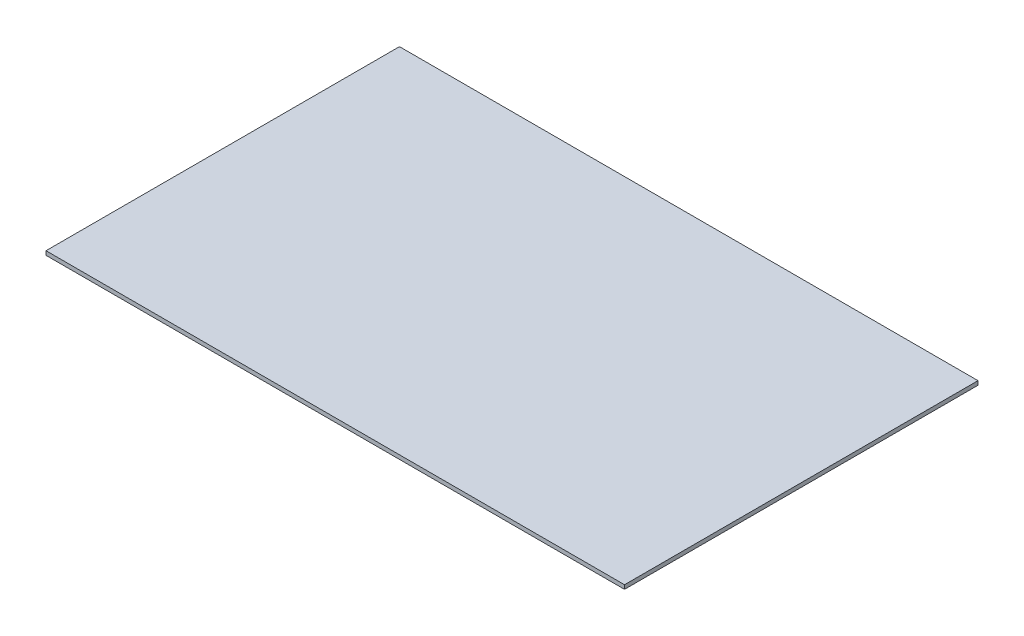
from build123d import *

# Parameters (mm, degrees)
SKETCH2_W           = 1370
SKETCH2_H           = 837.05
BOSS_EXTRUDE1_DEPTH = 9.525


with BuildPart() as part:
    # Sketch2 → Boss-Extrude1 (new body)
    with BuildSketch(Plane(origin=(0, 0, 0), x_dir=(1, 0, 0), z_dir=(0, 1, 0))):
        with Locations((685, 418.525)):
            Rectangle(SKETCH2_W, SKETCH2_H)
    extrude(amount=BOSS_EXTRUDE1_DEPTH)


solid = part.part
